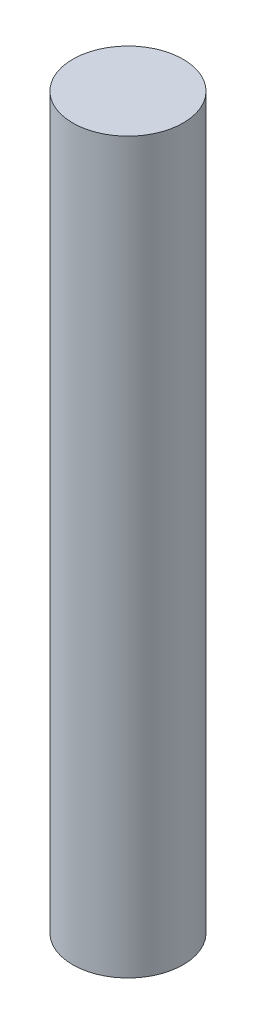
from build123d import *

# Parameters (mm, degrees)
SKETCH1_R           = 2.5
BOSS_EXTRUDE1_DEPTH = 33


with BuildPart() as part:
    # Sketch1 → Boss-Extrude1 (new body)
    with BuildSketch(Plane(origin=(0, 0, 0), x_dir=(1, 0, 0), z_dir=(0, 1, 0))):
        with Locations(Location((0, 0, 0), (0, 0, 270))):
            Circle(SKETCH1_R)
    extrude(amount=BOSS_EXTRUDE1_DEPTH)


solid = part.part
